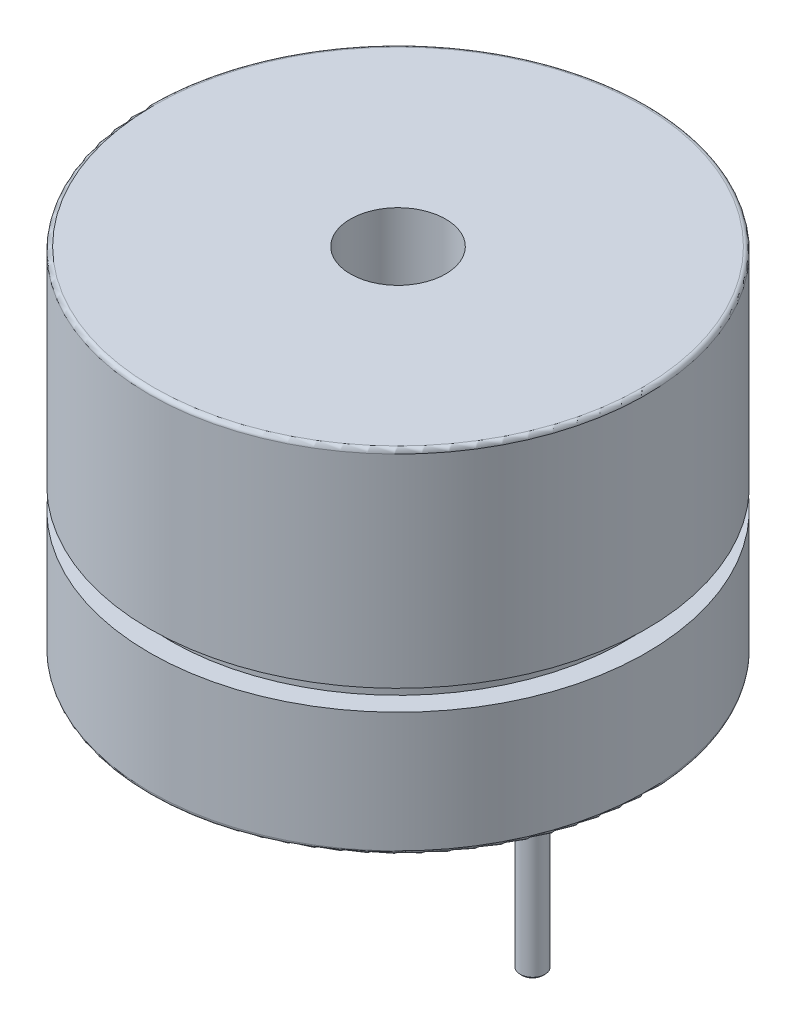
from build123d import *

# Parameters (mm, degrees)
SKETCH1_R           = 6
BOSS_EXTRUDE1_DEPTH = 3
SKETCH2_R           = 5.5
BOSS_EXTRUDE2_DEPTH = 0.5
SKETCH3_R           = 6
BOSS_EXTRUDE3_DEPTH = 5
SKETCH4_R           = 1.15
CUT_EXTRUDE1_DEPTH  = 5
SKETCH5_R           = 0.3
BOSS_EXTRUDE4_DEPTH = 5
FILLET1_R           = 0.1
CHAMFER1_SIZE       = 0.05


with BuildPart() as part:
    # Sketch1 → Boss-Extrude1 (new body)
    with BuildSketch(Plane(origin=(0, 0, 0), x_dir=(1, 0, 0), z_dir=(0, 1, 0))):
        with Locations(Location((0, 0, 0), (0, 0, 270))):
            Circle(SKETCH1_R)
    extrude(amount=BOSS_EXTRUDE1_DEPTH)

    # Sketch2 → Boss-Extrude2 (add)
    with BuildSketch(Plane(origin=(0, 3, 0), x_dir=(1, 0, 0), z_dir=(0, 1, 0))):
        with Locations(Location((0, 0, 0), (0, 0, 270))):
            Circle(SKETCH2_R)
    extrude(amount=BOSS_EXTRUDE2_DEPTH)

    # Sketch3 → Boss-Extrude3 (add)
    with BuildSketch(Plane(origin=(0, 3.5, 0), x_dir=(1, 0, 0), z_dir=(0, 1, 0))):
        with Locations(Location((0, 0, 0), (0, 0, 270))):
            Circle(SKETCH3_R)
    extrude(amount=BOSS_EXTRUDE3_DEPTH)

    # Sketch4 → Cut-Extrude1 (cut)
    with BuildSketch(Plane(origin=(0, 8.5, 0), x_dir=(1, 0, 0), z_dir=(0, 1, 0))):
        with Locations(Location((0, 0, 0), (0, 0, 270))):
            Circle(SKETCH4_R)
    extrude(amount=-CUT_EXTRUDE1_DEPTH, mode=Mode.SUBTRACT)

    # Sketch5 → Boss-Extrude4 (add)
    with BuildSketch(Plane.XZ):
        with Locations(Location((-3.25, 0, 0), (0, 0, 90))):
            Circle(SKETCH5_R)
        with Locations(Location((3.25, 0, 0), (0, 0, 90))):
            Circle(SKETCH5_R)
    extrude(amount=BOSS_EXTRUDE4_DEPTH)

    # Fillet1
    fillet1_edges = [part.edges().sort_by_distance(p)[0] for p in [
        (0, 8.5, -6),
        (0, 0, -6),
    ]]
    fillet(fillet1_edges, radius=FILLET1_R)

    # Chamfer1
    chamfer1_edges = [part.edges().sort_by_distance(p)[0] for p in [
        (-3.25, -5, -0.3),
        (3.25, -5, -0.3),
    ]]
    chamfer(chamfer1_edges, length=CHAMFER1_SIZE)


solid = part.part
